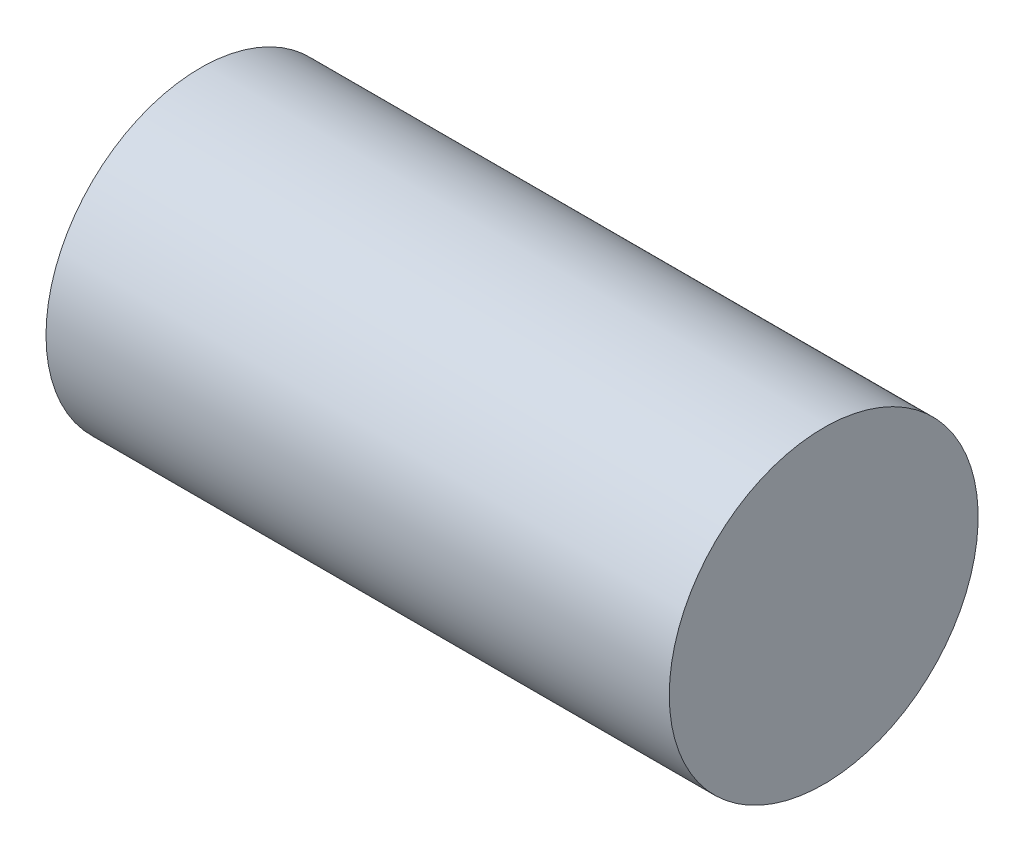
from build123d import *

# Parameters (mm, degrees)
SZKIC1_W = 149.855505277
SZKIC1_H = 37.132337591


with BuildPart() as part:
    # Szkic1 → Obrót1 (revolve)
    with BuildSketch(Plane.XY, mode=Mode.PRIVATE) as obr_t1_sk:
        with Locations((74.927752639, 18.566168796)):
            Rectangle(SZKIC1_W, SZKIC1_H)
    revolve(obr_t1_sk.sketch.rotate(Axis((0, 0, 0), (1, 0, 0)), 90), axis=Axis((0, 0, 0), (1, 0, 0)))


solid = part.part
